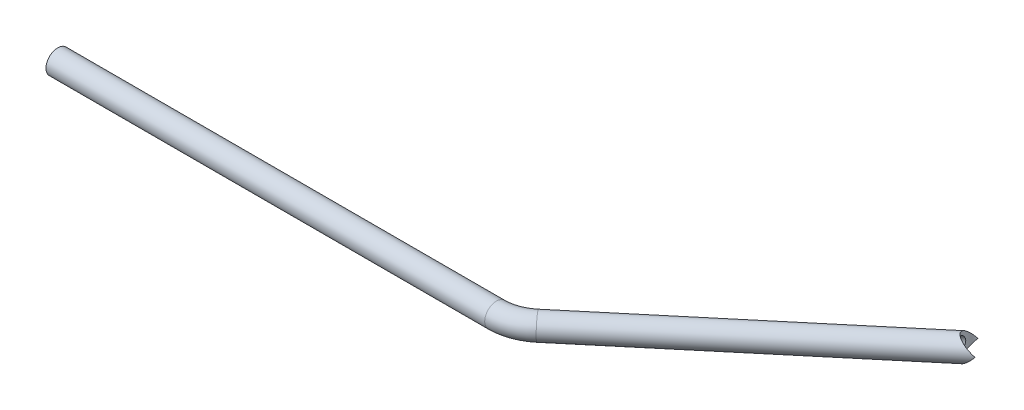
from build123d import *

# Parameters (mm, degrees)
SKETCH3_R               = 50
SKETCH3_R_2             = 35
CUT_EXTRUDE1_DEPTH      = 3189.175692756
CUT_EXTRUDE1_DEPTH_BACK = 3189.175692756
SKETCH4_R               = 50


with BuildPart() as part:
    # Sweep1: sweep along a path in Sketch2
    with BuildLine(Plane(origin=(0, 0, 0), x_dir=(1, 0, 0), z_dir=(0, 1, 0))) as sweep1_path:
        Line((0, 0), (1869.052500439, 0))
        ThreePointArc((1869.052500439, 0), (1937.456529104, 12.061475843), (1997.610022376, 46.791111376))
        Line((1997.610022376, 46.791111376), (3014.424780627, 900))
    # Sketch3 → Sweep1 (sweep)
    with BuildSketch(Plane(origin=(0, 0, 0), x_dir=(0, 0, -1), z_dir=(1, 0, 0))):
        Circle(SKETCH3_R)
        Circle(SKETCH3_R_2, mode=Mode.SUBTRACT)
    sweep(path=sweep1_path.line)

    # Sketch4 → Cut-Extrude1 (cut, two sides: drawn at the far end of the back side and taken through both)
    with BuildSketch(Plane(origin=(0, 0, 0), x_dir=(1, 0, 0), z_dir=(0, 1, 0)).offset(-CUT_EXTRUDE1_DEPTH_BACK)):
        with Locations((3014.424780627, 900)):
            Circle(SKETCH4_R)
    extrude(amount=CUT_EXTRUDE1_DEPTH + CUT_EXTRUDE1_DEPTH_BACK, mode=Mode.SUBTRACT)


solid = part.part
